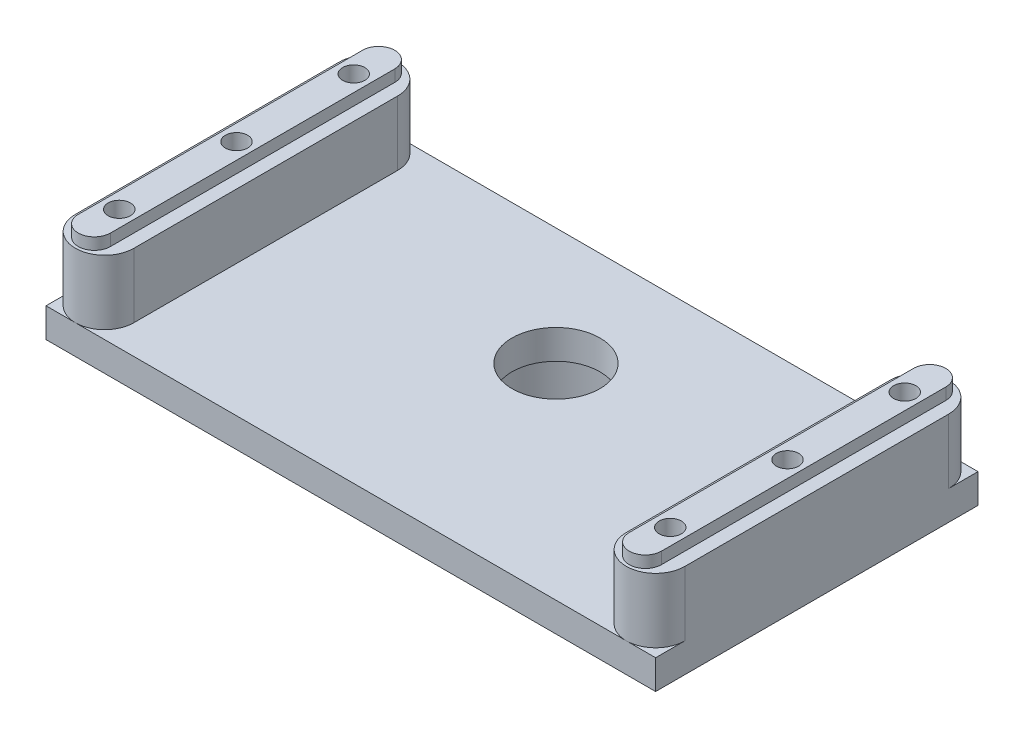
from build123d import *

# Parameters (mm, degrees)
SKETCH1_W           = 104
SKETCH1_H           = 55
BOSS_EXTRUDE1_DEPTH = 5
BOSS_EXTRUDE2_DEPTH = 11
BOSS_EXTRUDE3_DEPTH = 2
SKETCH4_R           = 1.9
CUT_EXTRUDE1_DEPTH  = 23
SKETCH5_R           = 17.25
SKETCH5_R_2         = 12.75
BOSS_EXTRUDE4_DEPTH = 10
SKETCH7_R           = 7.5
CUT_EXTRUDE2_DEPTH  = 35


with BuildPart() as part:
    # Sketch1 → Boss-Extrude1 (new body)
    with BuildSketch(Plane(origin=(0, 0, 0), x_dir=(1, 0, 0), z_dir=(0, 1, 0))):
        Rectangle(SKETCH1_W, SKETCH1_H)
    extrude(amount=BOSS_EXTRUDE1_DEPTH)

    # Sketch2 → Boss-Extrude2 (add)
    with BuildSketch(Plane(origin=(0, 5, 0), x_dir=(1, 0, 0), z_dir=(0, 1, 0))):
        with BuildLine():
            Line((-52, -22.5), (-52, 22.5))
            ThreePointArc((-52, 22.5), (-47, 27.5), (-42, 22.5))
            Line((-42, 22.5), (-42, -22.5))
            ThreePointArc((-42, -22.5), (-47, -27.5), (-52, -22.5))
        make_face()
        with BuildLine():
            Line((42, -22.5), (42, 22.5))
            ThreePointArc((42, 22.5), (47, 27.5), (52, 22.5))
            Line((52, 22.5), (52, -22.5))
            ThreePointArc((52, -22.5), (47, -27.5), (42, -22.5))
        make_face()
    extrude(amount=BOSS_EXTRUDE2_DEPTH)

    # Sketch3 → Boss-Extrude3 (add)
    with BuildSketch(Plane(origin=(0, 16, 0), x_dir=(1, 0, 0), z_dir=(0, 1, 0))):
        with BuildLine():
            Line((-49.75, -24.25), (-49.75, 24.25))
            ThreePointArc((-49.75, 24.25), (-47, 27), (-44.25, 24.25))
            Line((-44.25, 24.25), (-44.25, -24.25))
            ThreePointArc((-44.25, -24.25), (-47, -27), (-49.75, -24.25))
        make_face()
        with BuildLine():
            Line((44.25, -24.25), (44.25, 24.25))
            ThreePointArc((44.25, 24.25), (47, 27), (49.75, 24.25))
            Line((49.75, 24.25), (49.75, -24.25))
            ThreePointArc((49.75, -24.25), (47, -27), (44.25, -24.25))
        make_face()
    extrude(amount=BOSS_EXTRUDE3_DEPTH)

    # Sketch4 → Cut-Extrude1 (cut)
    with BuildSketch(Plane(origin=(0, 18, 0), x_dir=(1, 0, 0), z_dir=(0, 1, 0))):
        with Locations(Location((-47, 0, 0), (0, 0, 270))):
            Circle(SKETCH4_R)
        with Locations(Location((-47, 20, 0), (0, 0, 270))):
            Circle(SKETCH4_R)
        with Locations(Location((-47, -20, 0), (0, 0, 270))):
            Circle(SKETCH4_R)
        with Locations(Location((47, 0, 0), (0, 0, 270))):
            Circle(SKETCH4_R)
        with Locations(Location((47, 20, 0), (0, 0, 270))):
            Circle(SKETCH4_R)
        with Locations(Location((47, -20, 0), (0, 0, 270))):
            Circle(SKETCH4_R)
    extrude(amount=-CUT_EXTRUDE1_DEPTH, mode=Mode.SUBTRACT)

    # Sketch5 → Boss-Extrude4 (add)
    with BuildSketch(Plane.XZ):
        with Locations(Location((0, -7.5, 0), (0, 0, 270))):
            Circle(SKETCH5_R)
        with Locations(Location((0, -7.5, 0), (0, 0, 270))):
            Circle(SKETCH5_R_2, mode=Mode.SUBTRACT)
    extrude(amount=BOSS_EXTRUDE4_DEPTH)

    # Sketch7 → Cut-Extrude2 (cut)
    with BuildSketch(Plane.XZ.offset(10)):
        with Locations(Location((0, -7.5, 0), (0, 0, 270))):
            Circle(SKETCH7_R)
    extrude(amount=-CUT_EXTRUDE2_DEPTH, mode=Mode.SUBTRACT)


solid = part.part
